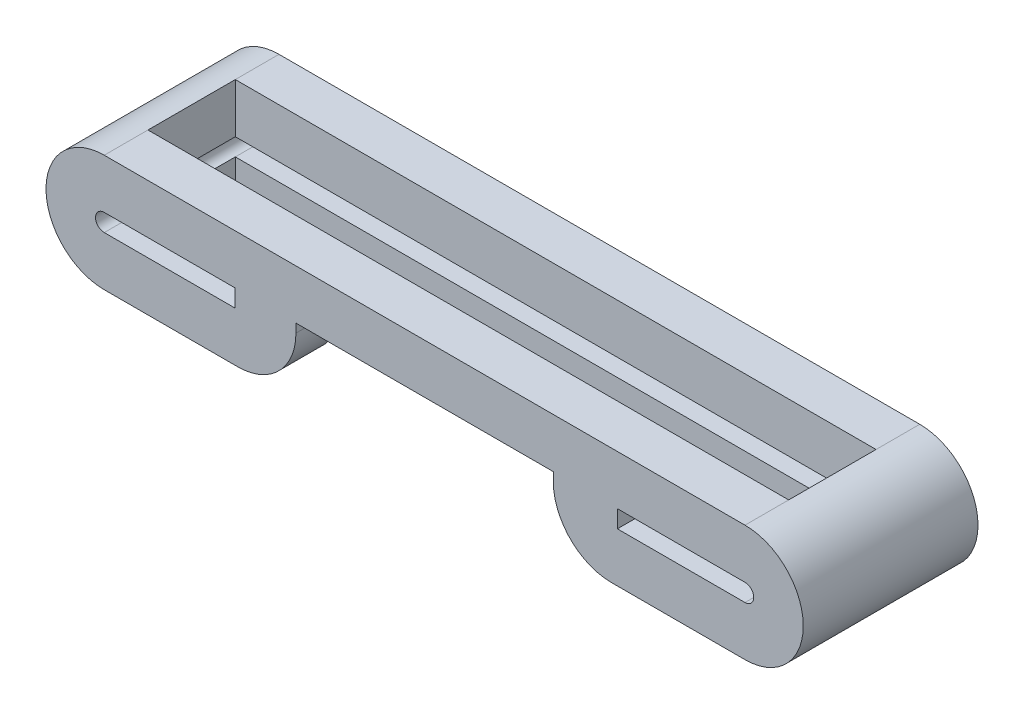
from build123d import *

# Parameters (mm, degrees)
BOSS_EXTRU_1_DEPTH      = 30
ESQUISSE2_W             = 110
ESQUISSE2_H             = 15
ENL_V_MAT_EXTRU_1_DEPTH = 30
ENL_V_START             = -10
ESQUISSE3_W             = 44.19
ESQUISSE3_H             = 7.5
ENL_V_MAT_EXTRU_2_DEPTH = 10
ESQUISSE4_W             = 5
ESQUISSE4_H             = 7.5
BOSS_EXTRU_2_DEPTH      = 10
ESQUISSE5_W             = 7.5
ESQUISSE5_H             = 3
BOSS_EXTRU_3_DEPTH      = 6
ESQUISSE6_W             = 7.5
ESQUISSE6_H             = 3
BOSS_EXTRU_4_DEPTH      = 5.5
CONG_1_R                = 10


with BuildPart() as part:
    # Esquisse1 → Boss.-Extru.1 (new body)
    with BuildSketch(Plane.XY):
        with BuildLine():
            Line((-55, 10), (55, 10))
            ThreePointArc((55, 10), (65, 0), (55, -10))
            Line((55, -10), (-55, -10))
            ThreePointArc((-55, -10), (-65, 0), (-55, 10))
        make_face()
        with BuildLine():
            Line((-55, 1.5), (55, 1.5))
            ThreePointArc((55, 1.5), (56.5, 0), (55, -1.5))
            Line((55, -1.5), (-55, -1.5))
            ThreePointArc((-55, -1.5), (-56.5, 0), (-55, 1.5))
        make_face(mode=Mode.SUBTRACT)
    extrude(amount=BOSS_EXTRU_1_DEPTH)

    # Esquisse2 → Enlèv. mat.-Extru.1 (cut)
    with BuildSketch(Plane(origin=(0, 10, 0), x_dir=(1, 0, 0), z_dir=(0, 1, 0))):
        with Locations((0, -15)):
            Rectangle(ESQUISSE2_W, ESQUISSE2_H)
    extrude(amount=-ENL_V_MAT_EXTRU_1_DEPTH, mode=Mode.SUBTRACT)

    # Esquisse3 → Enlèv. mat.-Extru.2 (cut)
    with BuildSketch(Plane(origin=(0, 10, 0), x_dir=(1, 0, 0), z_dir=(0, 1, 0)).offset(ENL_V_START)):
        with Locations((0, -26.25)):
            Rectangle(ESQUISSE3_W, ESQUISSE3_H)
    extrude(amount=-ENL_V_MAT_EXTRU_2_DEPTH, mode=Mode.SUBTRACT)

    # Esquisse4 → Boss.-Extru.2 (add)
    with BuildSketch(Plane(origin=(0, -1.5, 0), x_dir=(1, 0, 0), z_dir=(0, 1, 0))):
        with Locations((-24.595, -26.25)):
            Rectangle(ESQUISSE4_W, ESQUISSE4_H)
        with Locations((24.595, -26.25)):
            Rectangle(ESQUISSE4_W, ESQUISSE4_H)
    extrude(amount=BOSS_EXTRU_2_DEPTH)

    # Esquisse5 → Boss.-Extru.3 (add)
    with BuildSketch(Plane(origin=(27.095, 0, 0), x_dir=(0, 0, -1), z_dir=(1, 0, 0))):
        with Locations((-26.25, 0)):
            Rectangle(ESQUISSE5_W, ESQUISSE5_H)
    extrude(amount=BOSS_EXTRU_3_DEPTH)

    # Esquisse6 → Boss.-Extru.4 (add)
    with BuildSketch(Plane.ZY.offset(27.095)):
        with Locations((26.25, 0)):
            Rectangle(ESQUISSE6_W, ESQUISSE6_H)
    extrude(amount=BOSS_EXTRU_4_DEPTH)

    # Congé1
    cong_1_edges = [part.edges().sort_by_distance(p)[0] for p in [
        (22.095, -10, 26.25),
        (-22.095, -10, 26.25),
    ]]
    fillet(cong_1_edges, radius=CONG_1_R)


solid = part.part
